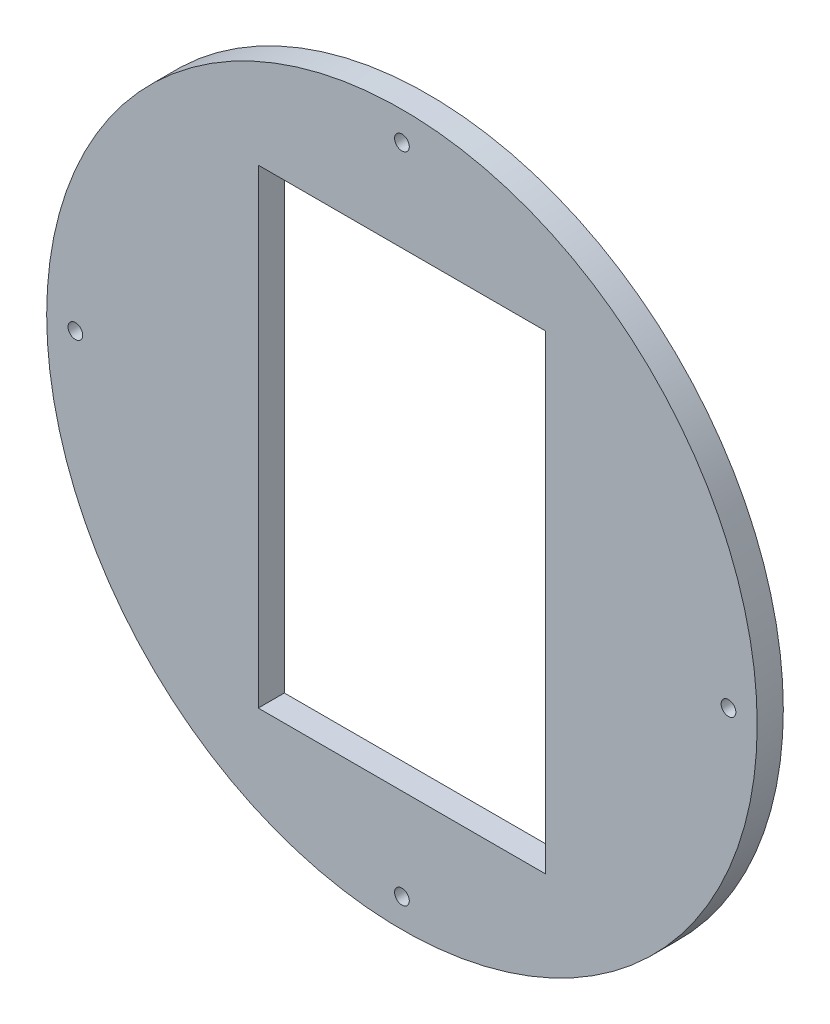
from build123d import *

# Parameters (mm, degrees)
SKETCH1_R           = 86.36
SKETCH1_R_2         = 1.7859375
BOSS_EXTRUDE1_DEPTH = 6.35
SKETCH2_W           = 69.85
SKETCH2_H           = 114.3
CUT_EXTRUDE1_DEPTH  = 123.296450071


with BuildPart() as part:
    # Sketch1 → Boss-Extrude1 (new body)
    with BuildSketch(Plane.XY):
        Circle(SKETCH1_R)
        with Locations((0, 79.375)):
            Circle(SKETCH1_R_2, mode=Mode.SUBTRACT)
        with Locations((79.375, 0)):
            Circle(SKETCH1_R_2, mode=Mode.SUBTRACT)
        with Locations((0, -79.375)):
            Circle(SKETCH1_R_2, mode=Mode.SUBTRACT)
        with Locations((-79.375, 0)):
            Circle(SKETCH1_R_2, mode=Mode.SUBTRACT)
    extrude(amount=BOSS_EXTRUDE1_DEPTH)

    # Sketch2 → Cut-Extrude1 (cut, through all)
    with BuildSketch(Plane(origin=(0, 0, 0), x_dir=(-1, 0, 0), z_dir=(0, 0, -1))):
        Rectangle(SKETCH2_W, SKETCH2_H)
    extrude(amount=-CUT_EXTRUDE1_DEPTH, mode=Mode.SUBTRACT)


solid = part.part
